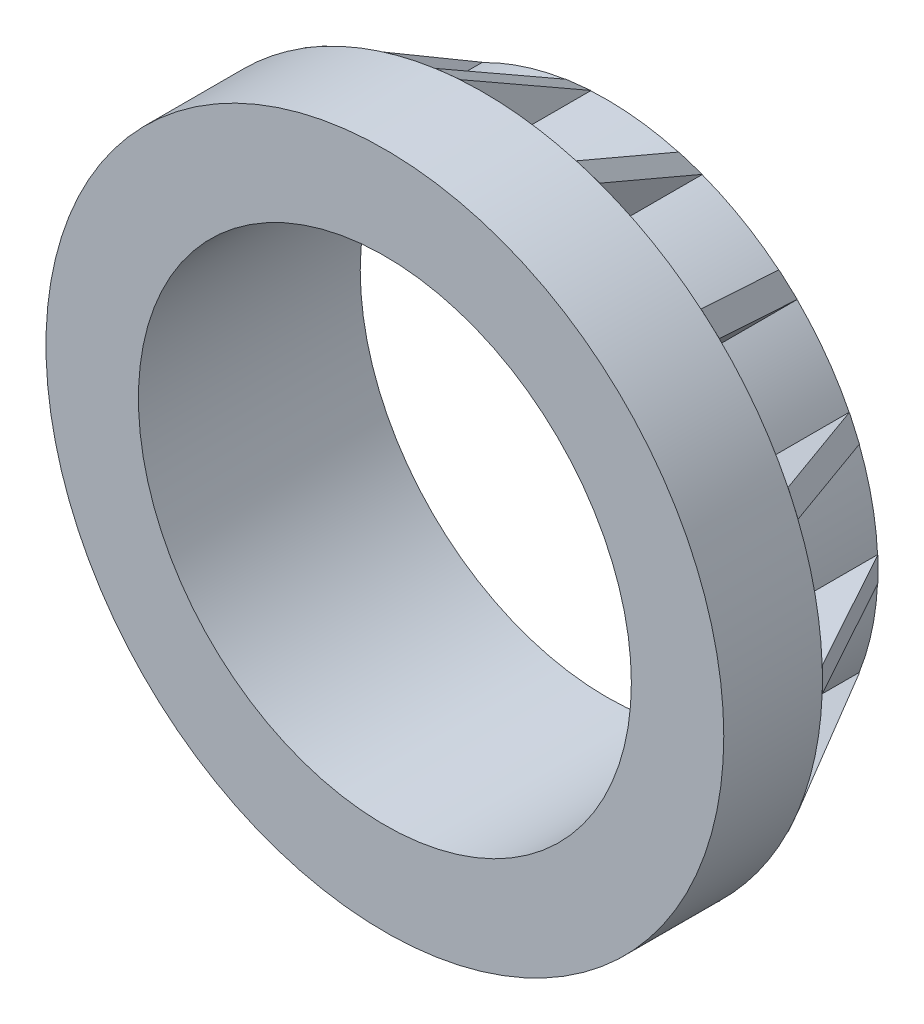
from build123d import *

# Parameters (mm, degrees)
SKETCH1_R           = 27.5
SKETCH1_R_2         = 20
BOSS_EXTRUDE1_DEPTH = 8
SKETCH2_R           = 22
SKETCH2_R_2         = 20
BOSS_EXTRUDE2_DEPTH = 10
BOSS_EXTRUDE3_DEPTH = 1
CIRPATTERN1_COUNT   = 15


with BuildPart() as part:
    # Sketch1 → Boss-Extrude1 (new body)
    with BuildSketch(Plane.XY):
        Circle(SKETCH1_R)
        Circle(SKETCH1_R_2, mode=Mode.SUBTRACT)
    extrude(amount=-BOSS_EXTRUDE1_DEPTH)

    # Sketch2 → Boss-Extrude2 (add)
    with BuildSketch(Plane(origin=(0, 0, -8), x_dir=(-1, 0, 0), z_dir=(0, 0, -1))):
        with Locations(Location((0, 0, 0), (0, 0, 180))):
            Circle(SKETCH2_R)
        with Locations(Location((0, 0, 0), (0, 0, 180))):
            Circle(SKETCH2_R_2, mode=Mode.SUBTRACT)
    extrude(amount=BOSS_EXTRUDE2_DEPTH)

    # Sketch3 → Boss-Extrude3 (add, symmetric)
    with BuildSketch(Plane(origin=(0, 0, 0), x_dir=(1, 0, 0), z_dir=(0, 1, 0))):
        Polygon((22, 18), (27.5, 8), (20.5, 8), (20.5, 18), align=None)
    boss_extrude3 = extrude(amount=BOSS_EXTRUDE3_DEPTH, both=True)

    # CirPattern1: Boss-Extrude3 ×15 about axis
    cirpattern1_axis = Axis((0, 0, 0), (0, 0, 1))
    for i in range(1, CIRPATTERN1_COUNT):
        add(boss_extrude3.rotate(cirpattern1_axis, i * 360 / CIRPATTERN1_COUNT))


solid = part.part
